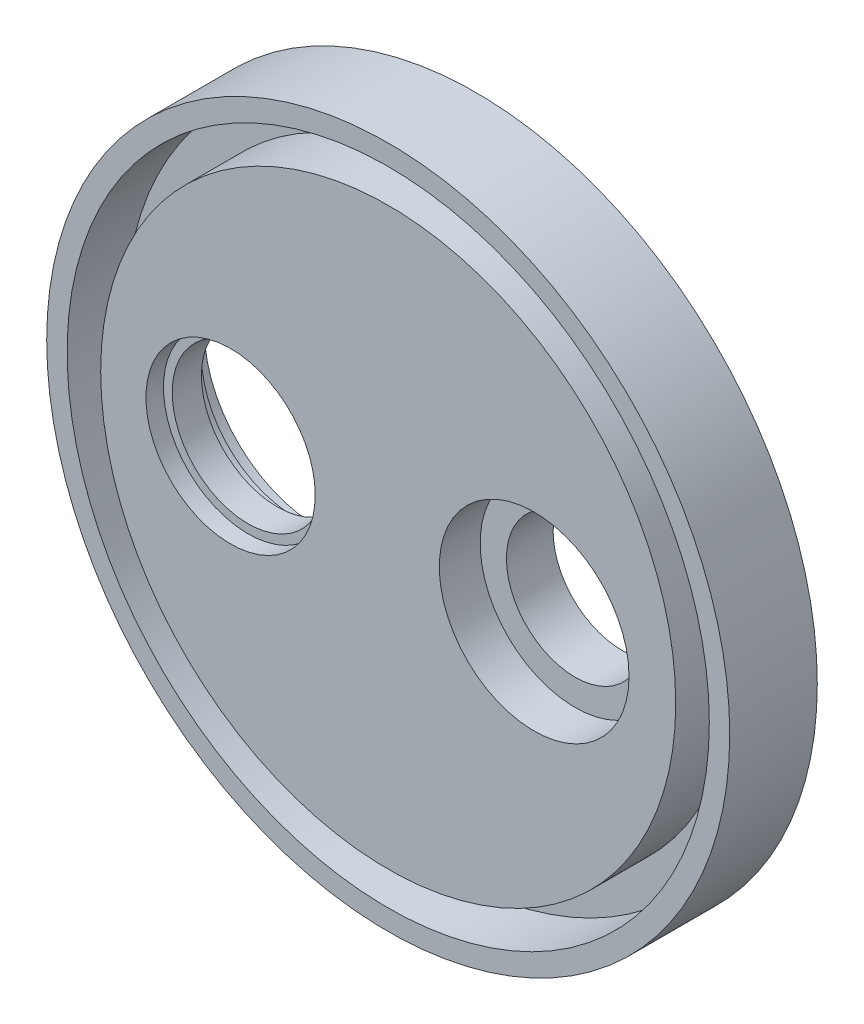
from build123d import *

# Parameters (mm, degrees)
SKETCH1_R           = 58.5
BOSS_EXTRUDE1_DEPTH = 15
SKETCH2_R           = 55
SKETCH2_R_2         = 49.25
CUT_EXTRUDE1_DEPTH  = 10
SKETCH3_R           = 11.75
CUT_EXTRUDE2_DEPTH  = 85.080318743
SKETCH4_R           = 16.25
CUT_EXTRUDE3_DEPTH  = 7
SKETCH5_R           = 19.5
CUT_EXTRUDE4_DEPTH  = 4
SKETCH6_R           = 16
CUT_EXTRUDE5_DEPTH  = 3
SKETCH7_R           = 14.5
CUT_EXTRUDE6_DEPTH  = 3
SKETCH8_R           = 13
CUT_EXTRUDE7_DEPTH  = 84.597248759


with BuildPart() as part:
    # Sketch1 → Boss-Extrude1 (new body)
    with BuildSketch(Plane.XY):
        Circle(SKETCH1_R)
    extrude(amount=BOSS_EXTRUDE1_DEPTH)

    # Sketch2 → Cut-Extrude1 (cut)
    with BuildSketch(Plane.XY.offset(15)):
        Circle(SKETCH2_R)
        Circle(SKETCH2_R_2, mode=Mode.SUBTRACT)
    extrude(amount=-CUT_EXTRUDE1_DEPTH, mode=Mode.SUBTRACT)

    # Sketch3 → Cut-Extrude2 (cut, through all)
    with BuildSketch(Plane(origin=(0, 0, 0), x_dir=(-1, 0, 0), z_dir=(0, 0, -1))):
        with Locations((-25, 0)):
            Circle(SKETCH3_R)
    extrude(amount=-CUT_EXTRUDE2_DEPTH, mode=Mode.SUBTRACT)

    # Sketch4 → Cut-Extrude3 (cut)
    with BuildSketch(Plane.XY.offset(15)):
        with Locations((25, 0)):
            Circle(SKETCH4_R)
    extrude(amount=-CUT_EXTRUDE3_DEPTH, mode=Mode.SUBTRACT)

    # Sketch5 → Cut-Extrude4 (cut)
    with BuildSketch(Plane(origin=(0, 0, 0), x_dir=(-1, 0, 0), z_dir=(0, 0, -1))):
        with Locations((27, 0)):
            Circle(SKETCH5_R)
    extrude(amount=-CUT_EXTRUDE4_DEPTH, mode=Mode.SUBTRACT)

    # Sketch6 → Cut-Extrude5 (cut)
    with BuildSketch(Plane(origin=(0, 0, 4), x_dir=(-1, 0, 0), z_dir=(0, 0, -1))):
        with Locations((27, 0)):
            Circle(SKETCH6_R)
    extrude(amount=-CUT_EXTRUDE5_DEPTH, mode=Mode.SUBTRACT)

    # Sketch7 → Cut-Extrude6 (cut)
    with BuildSketch(Plane.XY.offset(15)):
        with Locations((-27, 0)):
            Circle(SKETCH7_R)
    extrude(amount=-CUT_EXTRUDE6_DEPTH, mode=Mode.SUBTRACT)

    # Sketch8 → Cut-Extrude7 (cut, through all)
    with BuildSketch(Plane.XY.offset(12)):
        with Locations((-27, 0)):
            Circle(SKETCH8_R)
    extrude(amount=-CUT_EXTRUDE7_DEPTH, mode=Mode.SUBTRACT)


solid = part.part
